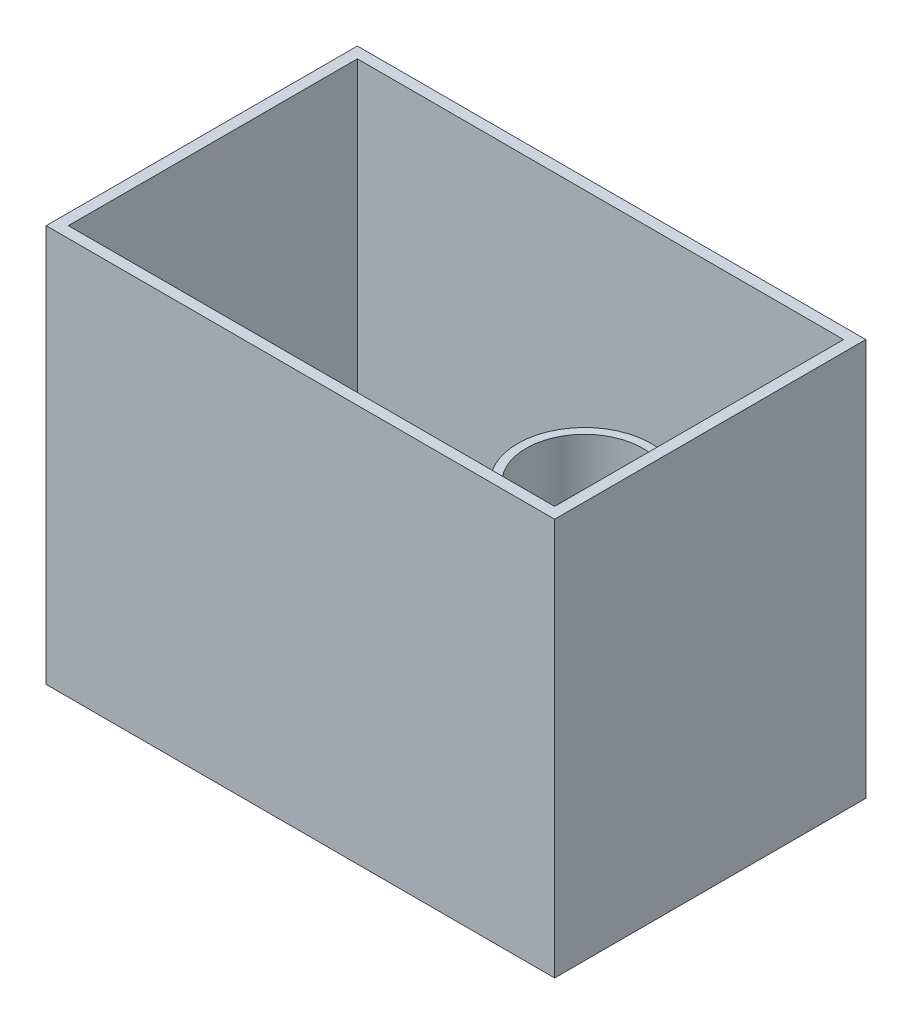
from build123d import *

# Parameters (mm, degrees)
SKETCH1_W           = 183
SKETCH1_H           = 112
BOSS_EXTRUDE1_DEPTH = 4
SKETCH2_W           = 183
SKETCH2_H           = 112
SKETCH2_W_2         = 175
SKETCH2_H_2         = 104
BOSS_EXTRUDE2_DEPTH = 139
SKETCH3_R           = 35.5
CUT_EXTRUDE1_DEPTH  = 4
SKETCH4_R           = 39.25
CUT_EXTRUDE2_DEPTH  = 2
SKETCH5_R           = 21
CUT_EXTRUDE3_DEPTH  = 4
BOSS_EXTRUDE3_START = 100
SKETCH6_R           = 24
SKETCH6_R_2         = 21
BOSS_EXTRUDE3_DEPTH = 100


with BuildPart() as part:
    # Sketch1 → Boss-Extrude1 (new body)
    with BuildSketch(Plane(origin=(0, 0, 0), x_dir=(1, 0, 0), z_dir=(0, 1, 0))):
        with Locations((91.5, -56)):
            Rectangle(SKETCH1_W, SKETCH1_H)
    extrude(amount=BOSS_EXTRUDE1_DEPTH)

    # Sketch2 → Boss-Extrude2 (add)
    with BuildSketch(Plane(origin=(0, 4, 0), x_dir=(1, 0, 0), z_dir=(0, 1, 0))):
        with Locations((91.5, -56)):
            Rectangle(SKETCH2_W, SKETCH2_H)
        with Locations((91.5, -56)):
            Rectangle(SKETCH2_W_2, SKETCH2_H_2, mode=Mode.SUBTRACT)
    extrude(amount=BOSS_EXTRUDE2_DEPTH)

    # Sketch3 → Cut-Extrude1 (cut)
    with BuildSketch(Plane(origin=(0, 0, 0), x_dir=(-1, 0, 0), z_dir=(0, -1, 0))):
        with Locations(Location((-61, -56, 0), (0, 0, 90))):
            Circle(SKETCH3_R)
    extrude(amount=-CUT_EXTRUDE1_DEPTH, mode=Mode.SUBTRACT)

    # Sketch4 → Cut-Extrude2 (cut)
    with BuildSketch(Plane(origin=(0, 0, 0), x_dir=(-1, 0, 0), z_dir=(0, -1, 0))):
        with Locations(Location((-61, -56, 0), (0, 0, 90))):
            Circle(SKETCH4_R)
    extrude(amount=-CUT_EXTRUDE2_DEPTH, mode=Mode.SUBTRACT)

    # Sketch5 → Cut-Extrude3 (cut)
    with BuildSketch(Plane(origin=(0, 4, 0), x_dir=(1, 0, 0), z_dir=(0, 1, 0))):
        with Locations(Location((137.75, -56, 0), (0, 0, 270))):
            Circle(SKETCH5_R)
    extrude(amount=-CUT_EXTRUDE3_DEPTH, mode=Mode.SUBTRACT)

    # Sketch6 → Boss-Extrude3 (add)
    with BuildSketch(Plane(origin=(0, 4, 0), x_dir=(1, 0, 0), z_dir=(0, 1, 0)).offset(BOSS_EXTRUDE3_START)):
        with Locations(Location((137.75, -56, 0), (0, 0, 270))):
            Circle(SKETCH6_R)
        with Locations(Location((137.75, -56, 0), (0, 0, 270))):
            Circle(SKETCH6_R_2, mode=Mode.SUBTRACT)
    extrude(amount=-BOSS_EXTRUDE3_DEPTH)


solid = part.part
